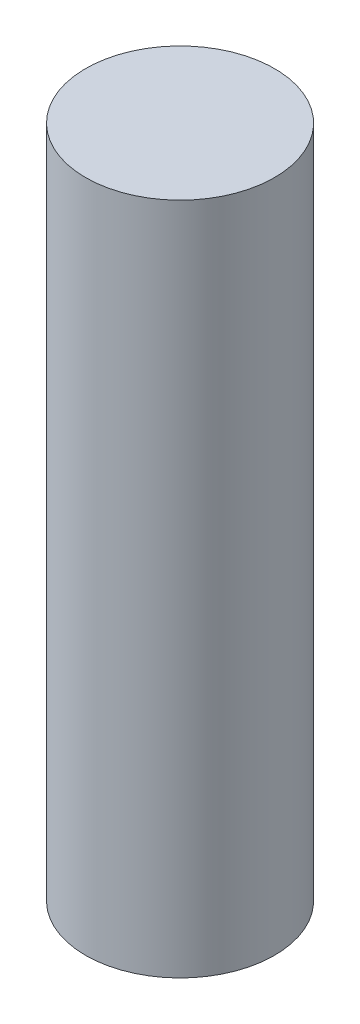
from build123d import *

# Parameters (mm, degrees)
ESQUISSE1_R        = 9.15
BOSS_EXTRU_1_DEPTH = 65.25


with BuildPart() as part:
    # Esquisse1 → Boss.-Extru.1 (new body)
    with BuildSketch(Plane(origin=(0, 0, 0), x_dir=(1, 0, 0), z_dir=(0, 1, 0))):
        with Locations(Location((0, 0, 0), (0, 0, 270))):
            Circle(ESQUISSE1_R)
    extrude(amount=BOSS_EXTRU_1_DEPTH)


solid = part.part
